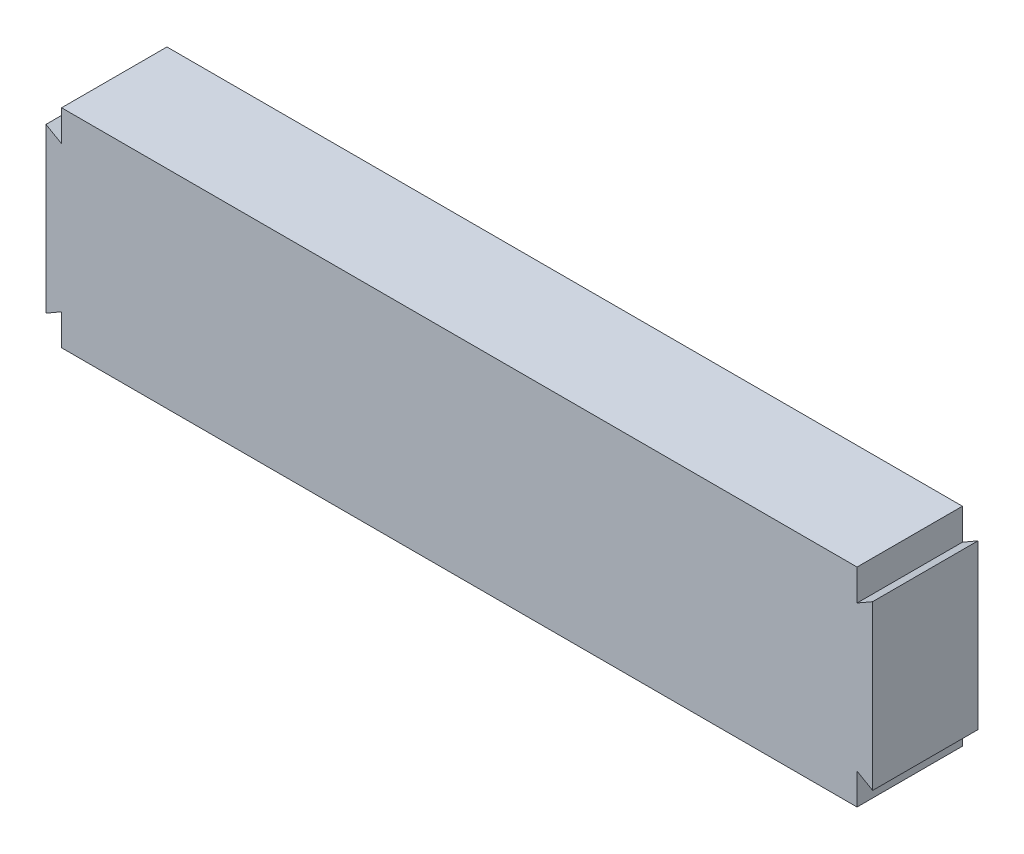
from build123d import *

# Parameters (mm, degrees)
BOSS_EXTRUDE1_DEPTH = 10


with BuildPart() as part:
    # Sketch1 → Boss-Extrude1 (new body)
    with BuildSketch(Plane.XY):
        Polygon((-37.843418667, -19.932), (37.656581333, -19.932), (37.656581333, -16.9724), (39.136381333, -17.826762928), (39.136381333, -2.306570405), (37.656581333, -3.160933333), (37.656581333, -0.201333333), (-37.843418667, -0.201333333), (-37.843418667, -3.160933333), (-39.323218667, -2.306570405), (-39.323218667, -17.826762928), (-37.843418667, -16.9724), align=None)
    extrude(amount=BOSS_EXTRUDE1_DEPTH)


solid = part.part
